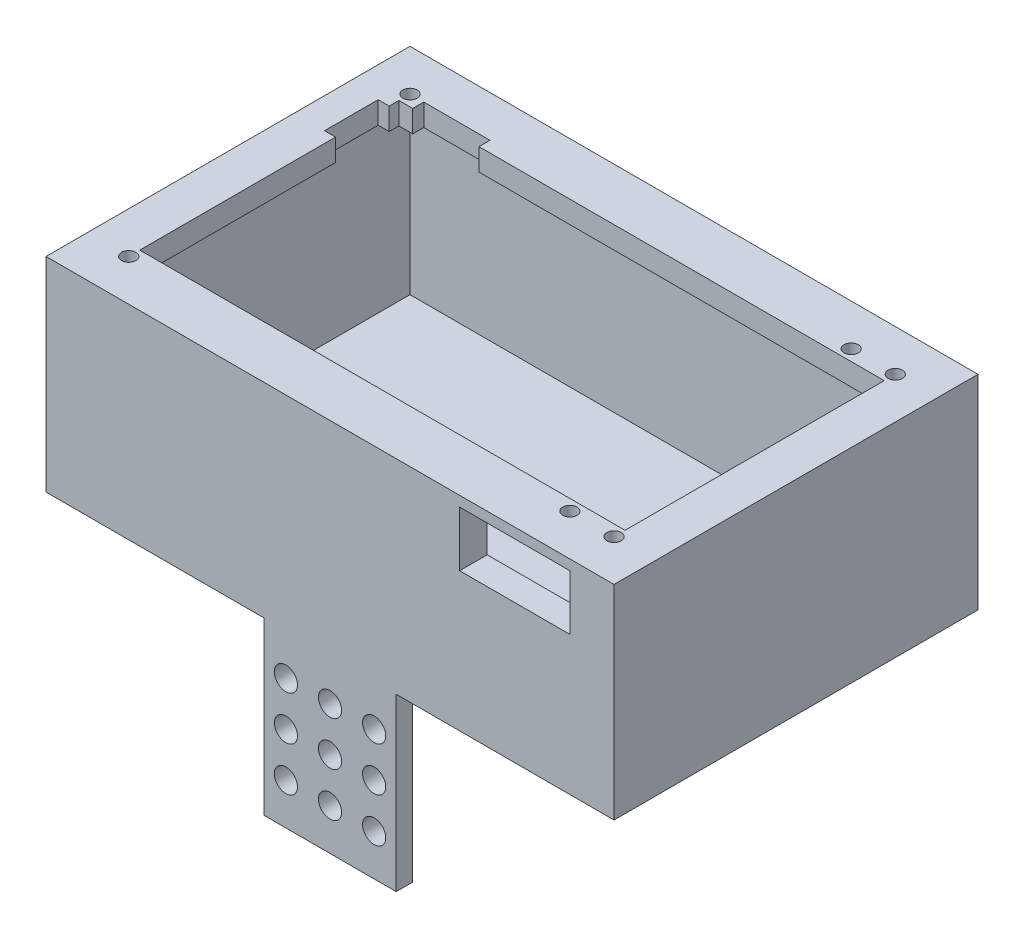
from build123d import *

# Parameters (mm, degrees)
SKETCH_1_W          = 93
SKETCH_1_H          = 56
EXTRUDE_1_DEPTH     = 4
SKETCH_2_R          = 1.3
CUT_EXTRUDE_1_DEPTH = 4
SKETCH_3_W          = 5
SKETCH_3_H          = 56
EXTRUDE_2_DEPTH     = 34
SKETCH_4_W          = 103
SKETCH_4_H          = 66
EXTRUDE_3_DEPTH     = 3
CUT_EXTRUDE_2_DEPTH = 21
SKETCH_6_W          = 24
SKETCH_6_H          = 68
EXTRUDE_4_DEPTH     = 5
SKETCH_7_R          = 2.1
CUT_EXTRUDE_3_DEPTH = 5
SKETCH_9_W          = 24
SKETCH_9_H          = 31
SKETCH_9_R          = 1.8
CUT_EXTRUDE_5_DEPTH = 2
SKETCH_10_W         = 20
SKETCH_10_H         = 10
CUT_EXTRUDE_6_DEPTH = 10


with BuildPart() as part:
    # 草圖1 → 填料-伸長1 (new body)
    with BuildSketch(Plane(origin=(0, 0, 0), x_dir=(1, 0, 0), z_dir=(0, 1, 0))):
        with Locations((46.5, 28)):
            Rectangle(SKETCH_1_W, SKETCH_1_H)
    extrude(amount=EXTRUDE_1_DEPTH)

    # 草圖2 → 除料-伸長1 (cut)
    with BuildSketch(Plane(origin=(0, 4, 0), x_dir=(1, 0, 0), z_dir=(0, 1, 0))):
        with Locations(Location((90.5, 53.5, 0), (0, 0, 270))):
            Circle(SKETCH_2_R)
        with Locations(Location((90.5, 2.5, 0), (0, 0, 270))):
            Circle(SKETCH_2_R)
        with Locations(Location((2.5, 53.5, 0), (0, 0, 270))):
            Circle(SKETCH_2_R)
        with Locations(Location((2.5, 2.5, 0), (0, 0, 270))):
            Circle(SKETCH_2_R)
        with Locations(Location((82.5, 2.5, 0), (0, 0, 270))):
            Circle(SKETCH_2_R)
        with Locations(Location((82.5, 53.5, 0), (0, 0, 270))):
            Circle(SKETCH_2_R)
    extrude(amount=-CUT_EXTRUDE_1_DEPTH, mode=Mode.SUBTRACT)

    # 草圖3 → 填料-伸長2 (add)
    with BuildSketch(Plane(origin=(0, 4, 0), x_dir=(1, 0, 0), z_dir=(0, 1, 0))):
        with Locations((-2.5, 28)):
            Rectangle(SKETCH_3_W, SKETCH_3_H)
        Polygon((93, 56), (98, 56), (98, 61), (-5, 61), (-5, 56), (0, 56), align=None)
        with Locations((95.5, 28)):
            Rectangle(SKETCH_3_W, SKETCH_3_H)
        Polygon((98, 0), (98, -5), (-5, -5), (-5, 0), (0, 0), (93, 0), align=None)
    extrude(amount=-EXTRUDE_2_DEPTH)

    # 草圖4 → 填料-伸長3 (add)
    with BuildSketch(Plane(origin=(0, -30, 0), x_dir=(-1, 0, 0), z_dir=(0, -1, 0))):
        with Locations((-46.5, 28)):
            Rectangle(SKETCH_4_W, SKETCH_4_H)
    extrude(amount=EXTRUDE_3_DEPTH)

    # 草圖5 → 除料-伸長2 (cut)
    with BuildSketch(Plane(origin=(0, 4, 0), x_dir=(1, 0, 0), z_dir=(0, 1, 0))):
        Polygon((2.5, 51.5), (5, 51.5), (5, 53.5), (17, 53.5), (17, 51.5), (90.5, 51.5), (90.5, 4.5), (2.5, 4.5), (2.5, 40), (0.5, 40), (0.5, 49.733475986), (2.5, 49.733475986), align=None)
    extrude(amount=-CUT_EXTRUDE_2_DEPTH, mode=Mode.SUBTRACT)

    # 草圖6 → 填料-伸長4 (add)
    with BuildSketch(Plane.XY.offset(5)):
        with Locations((46.5, -30)):
            Rectangle(SKETCH_6_W, SKETCH_6_H)
    extrude(amount=-EXTRUDE_4_DEPTH)

    # 草圖7 → 除料-伸長3 (cut)
    with BuildSketch(Plane.XY.offset(5)):
        with Locations((38.5, -40.5)):
            Circle(SKETCH_7_R)
        with Locations((38.5, -48.5)):
            Circle(SKETCH_7_R)
        with Locations((38.5, -56.5)):
            Circle(SKETCH_7_R)
        with Locations((46.5, -40.5)):
            Circle(SKETCH_7_R)
        with Locations((46.5, -48.5)):
            Circle(SKETCH_7_R)
        with Locations((46.5, -56.5)):
            Circle(SKETCH_7_R)
        with Locations((54.5, -40.5)):
            Circle(SKETCH_7_R)
        with Locations((54.5, -48.5)):
            Circle(SKETCH_7_R)
        with Locations((54.5, -56.5)):
            Circle(SKETCH_7_R)
    extrude(amount=-CUT_EXTRUDE_3_DEPTH, mode=Mode.SUBTRACT)

    # 草圖9 → 除料-伸長5 (cut)
    with BuildSketch(Plane(origin=(0, 0, 0), x_dir=(-1, 0, 0), z_dir=(0, 0, -1))):
        with Locations((-46.5, -48.5)):
            Rectangle(SKETCH_9_W, SKETCH_9_H)
        with Locations((-54.5, -40.5)):
            Circle(SKETCH_9_R, mode=Mode.SUBTRACT)
        with Locations((-46.5, -40.5)):
            Circle(SKETCH_9_R, mode=Mode.SUBTRACT)
        with Locations((-38.5, -40.5)):
            Circle(SKETCH_9_R, mode=Mode.SUBTRACT)
        with Locations((-38.5, -48.5)):
            Circle(SKETCH_9_R, mode=Mode.SUBTRACT)
        with Locations((-46.5, -48.5)):
            Circle(SKETCH_9_R, mode=Mode.SUBTRACT)
        with Locations((-54.5, -48.5)):
            Circle(SKETCH_9_R, mode=Mode.SUBTRACT)
        with Locations((-54.5, -56.5)):
            Circle(SKETCH_9_R, mode=Mode.SUBTRACT)
        with Locations((-46.5, -56.5)):
            Circle(SKETCH_9_R, mode=Mode.SUBTRACT)
        with Locations((-38.5, -56.5)):
            Circle(SKETCH_9_R, mode=Mode.SUBTRACT)
    extrude(amount=-CUT_EXTRUDE_5_DEPTH, mode=Mode.SUBTRACT)

    # 草圖10 → 除料-伸長6 (cut)
    with BuildSketch(Plane.XY.offset(5)):
        with Locations((80, -2.85)):
            Rectangle(SKETCH_10_W, SKETCH_10_H)
    extrude(amount=-CUT_EXTRUDE_6_DEPTH, mode=Mode.SUBTRACT)


solid = part.part
